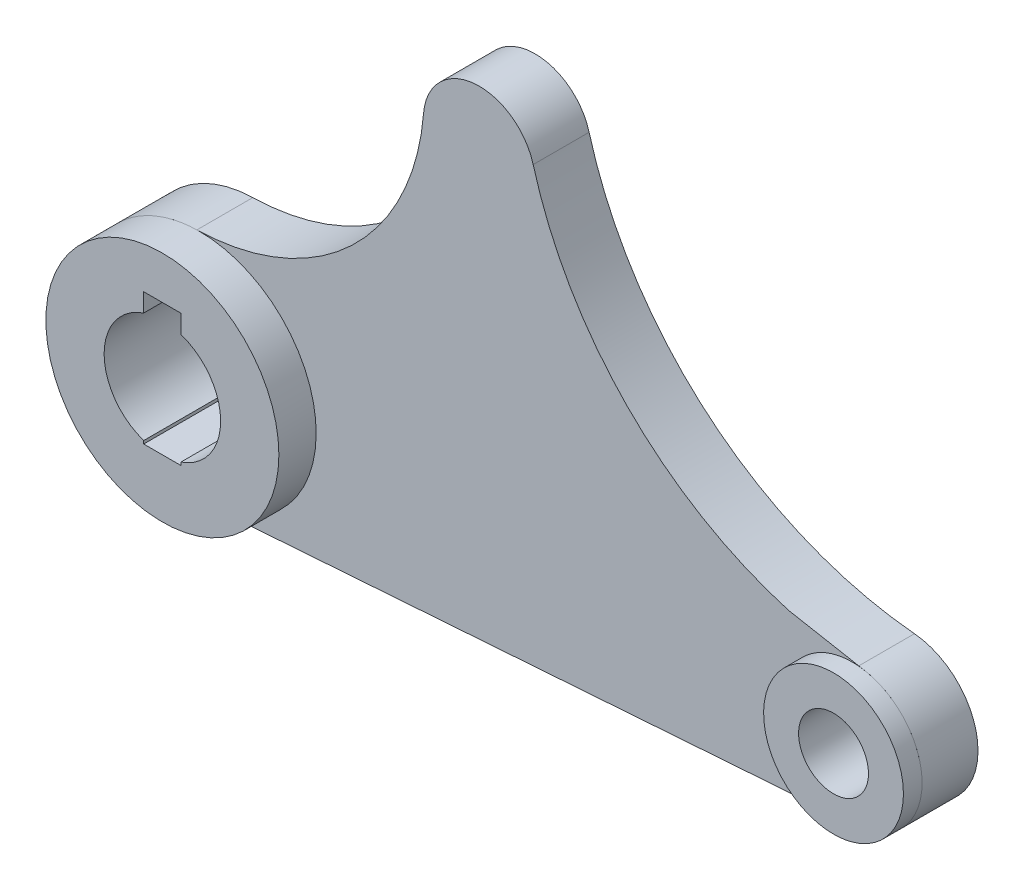
from build123d import *

# Parameters (mm, degrees)
EXTRUDE_1_DEPTH     = 12
SKETCH_2_R          = 25
EXTRUDE_2_DEPTH     = 8
SKETCH_3_R          = 15
EXTRUDE_3_DEPTH     = 4
SKETCH_4_R          = 12.5
CUT_EXTRUDE_1_DEPTH = 177.49083481
SKETCH_5_R          = 7.5
CUT_EXTRUDE_2_DEPTH = 181
SKETCH_6_R          = 5
CUT_EXTRUDE_3_DEPTH = 181
SKETCH_7_W          = 8
SKETCH_7_H          = 28.3
CUT_EXTRUDE_4_DEPTH = 181
CUT_EXTRUDE_5_DEPTH = 181


with BuildPart() as part:
    # 草图1 → 凸台-拉伸1 (new body)
    with BuildSketch(Plane.XY):
        with BuildLine():
            Line((1.7857, -24.9361), (141.0714, -14.9617))
            ThreePointArc((141.0714, -14.9617), (154.999285666, -0.147629307), (141.366, 14.938))
            ThreePointArc((141.366, 14.938), (97.381092038, 33.192459242), (71.563, 73.209))
            ThreePointArc((71.563, 73.209), (58.859898224, 81.945744775), (48.0395, 70.9631))
            ThreePointArc((48.0395, 70.9631), (32.546502595, 38.63938443), (-0.5987, 24.992))
            ThreePointArc((-0.5987, 24.992), (-24.970692218, -1.192910796), (1.7857, -24.9361))
        make_face()
    extrude(amount=EXTRUDE_1_DEPTH)

    # 草图2 → 凸台-拉伸2 (add)
    with BuildSketch(Plane.XY.offset(12)):
        with Locations(Location((0, 0, 0), (0, 0, 90.991687083))):
            Circle(SKETCH_2_R)
    extrude(amount=EXTRUDE_2_DEPTH)

    # 草图3 → 凸台-拉伸3 (add)
    with BuildSketch(Plane.XY.offset(12)):
        with Locations(Location((140, 0, 0), (0, 0, 278.719863289))):
            Circle(SKETCH_3_R)
    extrude(amount=EXTRUDE_3_DEPTH)

    # 草图4 → 切除-拉伸1 (cut, through all)
    with BuildSketch(Plane.XY.offset(20)):
        Circle(SKETCH_4_R)
    extrude(amount=-CUT_EXTRUDE_1_DEPTH, mode=Mode.SUBTRACT)

    # 草图5 → 切除-拉伸2 (cut, symmetric)
    with BuildSketch(Plane.XY.offset(16)):
        with Locations((140, 0)):
            Circle(SKETCH_5_R)
    extrude(amount=CUT_EXTRUDE_2_DEPTH, both=True, mode=Mode.SUBTRACT)

    # 草图6 → 切除-拉伸3 (cut, symmetric)
    with BuildSketch(Plane.XY.offset(12)):
        with Locations((60, 70)):
            Circle(SKETCH_6_R)
    extrude(amount=CUT_EXTRUDE_3_DEPTH, both=True, mode=Mode.SUBTRACT)

    # 草图7 → 切除-拉伸4 (cut, symmetric)
    with BuildSketch(Plane.XY.offset(20)):
        with Locations((0, 1.65)):
            Rectangle(SKETCH_7_W, SKETCH_7_H)
    extrude(amount=CUT_EXTRUDE_4_DEPTH, both=True, mode=Mode.SUBTRACT)

    # 草图8 → 切除-拉伸5 (cut, symmetric)
    with BuildSketch(Plane.XY.offset(12)):
        with BuildLine():
            ThreePointArc((74.3392, 15.8013), (70.465953911, 28.470108496), (64.4517, 40.2739))
            ThreePointArc((64.4517, 40.2739), (58.9398, 41.5464), (57.6673, 36.0345))
            ThreePointArc((57.6673, 36.0345), (63.048521634, 25.473252625), (66.514, 14.138))
            ThreePointArc((66.514, 14.138), (71.256091393, 11.067205434), (74.3392, 15.8013))
        make_face()
    extrude(amount=CUT_EXTRUDE_5_DEPTH, both=True, mode=Mode.SUBTRACT)


solid = part.part
